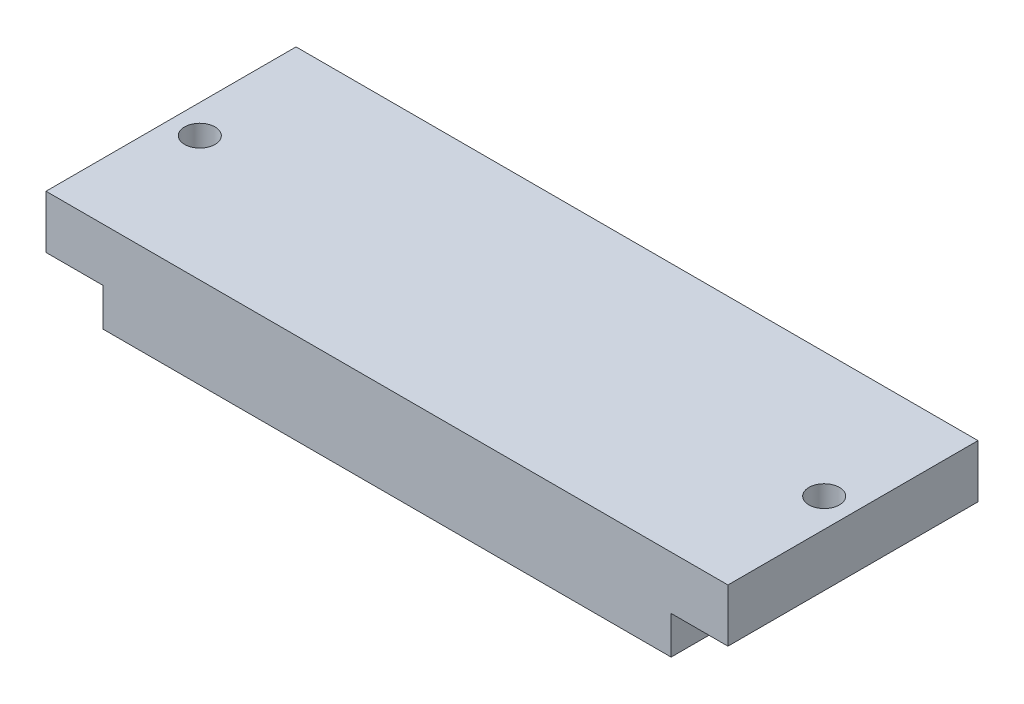
from build123d import *

# Parameters (mm, degrees)
BOSS_EXTRUDE1_DEPTH    = 41.91
F_10_CLEARANCE_HOLE1_D = 5.1054


with BuildPart() as part:
    # Sketch1 → Boss-Extrude1 (new body)
    with BuildSketch(Plane.XY):
        Polygon((0, 0), (114.3, 0), (114.3, -8.89), (104.775, -8.89), (104.775, -15.24), (9.525, -15.24), (9.525, -8.89), (0, -8.89), align=None)
    extrude(amount=BOSS_EXTRUDE1_DEPTH)

    # #10 Clearance Hole1 (through all)
    with Locations(Plane(origin=(4.826, 0, 20.955), x_dir=(0, 0, 1), z_dir=(0, 1, 0))):
        with Locations((0, 0), (0, 104.648)):
            Hole(F_10_CLEARANCE_HOLE1_D / 2)


solid = part.part
